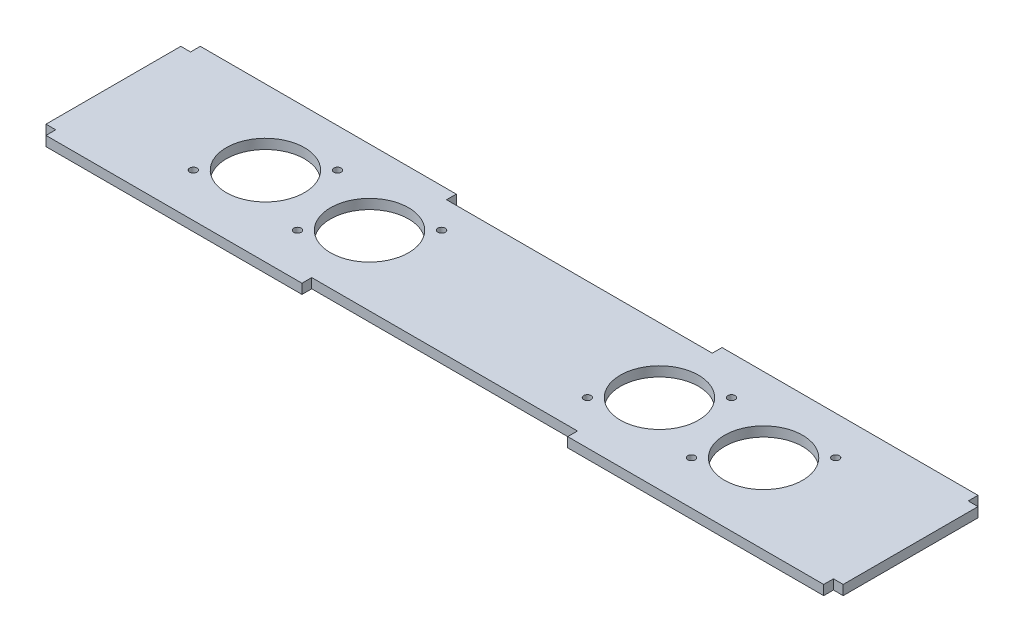
from build123d import *

# Parameters (mm, degrees)
SKETCH2_W                 = 490
SKETCH2_H                 = 94.85
BOSS_EXTRUDE1_DEPTH       = 6
SKETCH4_W                 = 6
SKETCH4_H                 = 6
CUT_EXTRUDE2_DEPTH        = 500.131768674
SKETCH5_W                 = 163.333333334
SKETCH5_H                 = 6
CUT_EXTRUDE3_DEPTH        = 500.131768674
M4_CLEARANCE_SLOT1_D      = 4.5
M4_CLEARANCE_SLOT1_DEPTH  = 18
M4_CLEARANCE_SLOT1_TIP    = 1.351936393
M45_CLEARANCE_SLOT1_D     = 48
M45_CLEARANCE_SLOT1_DEPTH = 18
M45_CLEARANCE_SLOT1_TIP   = 14.420654857


with BuildPart() as part:
    # Sketch2 → Boss-Extrude1 (new body)
    with BuildSketch(Plane(origin=(0, 0, 0), x_dir=(1, 0, 0), z_dir=(0, 1, 0))):
        with Locations((245, 47.425)):
            Rectangle(SKETCH2_W, SKETCH2_H)
    extrude(amount=BOSS_EXTRUDE1_DEPTH)

    # Sketch4 → Cut-Extrude2 (cut, through all)
    with BuildSketch(Plane(origin=(0, 6, 0), x_dir=(1, 0, 0), z_dir=(0, 1, 0))):
        with Locations((487, 3)):
            Rectangle(SKETCH4_W, SKETCH4_H)
        with Locations((487, 91.85)):
            Rectangle(SKETCH4_W, SKETCH4_H)
        with Locations((3, 91.85)):
            Rectangle(SKETCH4_W, SKETCH4_H)
        with Locations((3, 3)):
            Rectangle(SKETCH4_W, SKETCH4_H)
    extrude(amount=-CUT_EXTRUDE2_DEPTH, mode=Mode.SUBTRACT)

    # Sketch5 → Cut-Extrude3 (cut, through all)
    with BuildSketch(Plane(origin=(0, 6, 0), x_dir=(1, 0, 0), z_dir=(0, 1, 0))):
        with Locations((245, 91.85)):
            Rectangle(SKETCH5_W, SKETCH5_H)
        with Locations((245, 3)):
            Rectangle(SKETCH5_W, SKETCH5_H)
    extrude(amount=-CUT_EXTRUDE3_DEPTH, mode=Mode.SUBTRACT)

    # M4 Clearance Slot1
    with Locations(Plane(origin=(0, 6, 0), x_dir=(1, 0, 0), z_dir=(0, 1, 0))):
        with Locations((375.95208337, 26.806250977), (420.25208337, 71.106250977), (356.25208337, 71.106250977), (311.95208337, 26.806250977), (178.04791663, 71.106250977), (133.74791663, 26.806250977), (114.04791663, 71.106250977), (69.74791663, 26.806250977)):
            Hole(M4_CLEARANCE_SLOT1_D / 2, depth=M4_CLEARANCE_SLOT1_DEPTH)
            with Locations((0, 0, -(M4_CLEARANCE_SLOT1_DEPTH + M4_CLEARANCE_SLOT1_TIP / 2))):  # 118° drill point
                Cone(0, M4_CLEARANCE_SLOT1_D / 2, M4_CLEARANCE_SLOT1_TIP, mode=Mode.SUBTRACT)

    # M45 Clearance Slot1
    with Locations(Plane(origin=(0, 6, 0), x_dir=(1, 0, 0), z_dir=(0, 1, 0))):
        with Locations((91.89791663, 48.956250977), (155.89791663, 48.956250977), (334.10208337, 48.956250977), (398.10208337, 48.956250977)):
            Hole(M45_CLEARANCE_SLOT1_D / 2, depth=M45_CLEARANCE_SLOT1_DEPTH)
            with Locations((0, 0, -(M45_CLEARANCE_SLOT1_DEPTH + M45_CLEARANCE_SLOT1_TIP / 2))):  # 118° drill point
                Cone(0, M45_CLEARANCE_SLOT1_D / 2, M45_CLEARANCE_SLOT1_TIP, mode=Mode.SUBTRACT)


solid = part.part
